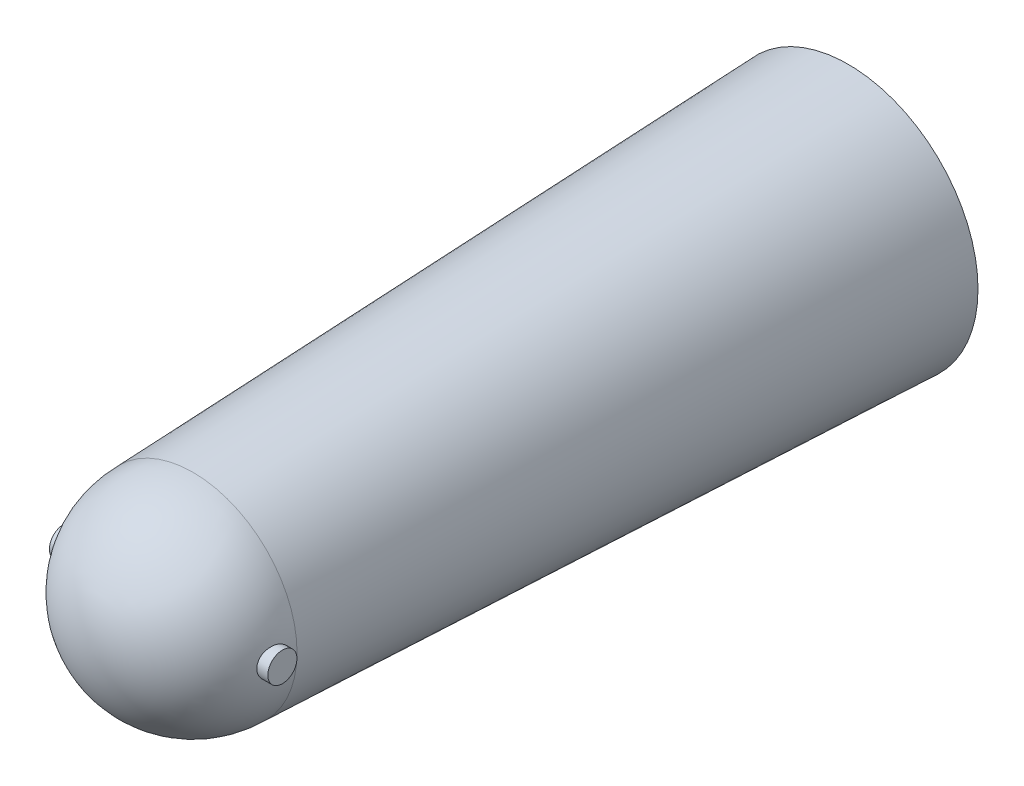
from build123d import *

# Parameters (mm, degrees)
SKETCH1_R           = 89.125
BOSS_EXTRUDE1_DEPTH = 450
BOSS_EXTRUDE1_TAPER = 2.25
SKETCH5_R           = 10
BOSS_EXTRUDE3_DEPTH = 10
SKETCH4_R           = 10
BOSS_EXTRUDE4_DEPTH = 10
SKETCH7_R           = 5
CUT_EXTRUDE1_DEPTH  = 10
CUT_EXTRUDE2_START  = 10
SKETCH6_R           = 5
CUT_EXTRUDE2_DEPTH  = 10


with BuildPart() as part:
    # Sketch1 → Boss-Extrude1 (new body)
    with BuildSketch(Plane.XY):
        Circle(SKETCH1_R)
    extrude(amount=BOSS_EXTRUDE1_DEPTH, taper=BOSS_EXTRUDE1_TAPER)

    # Sketch2 → Revolve1 (revolve)
    with BuildSketch(Plane.XY.offset(450)):
        with BuildLine():
            Line((0, 71.444451847), (0, -71.444451847))
            ThreePointArc((0, -71.444451847), (-71.444451847, 0), (0, 71.444451847))
        make_face()
    revolve(axis=Axis((0, 71.444451847, 450), (0, -1, 0)))

    # Sketch3 → Cut-Revolve1 (revolve, cut)
    with BuildSketch(Plane(origin=(0, 0, 0), x_dir=(-1, 0, 0), z_dir=(0, 0, -1))):
        with BuildLine():
            Line((-79, 0), (79, 0))
            ThreePointArc((79, 0), (0, -79), (-79, 0))
        make_face()
    revolve(axis=Axis((79, 0, 0), (-1, 0, 0)), mode=Mode.SUBTRACT)

    # Sketch7 → Cut-Extrude1 (cut)
    with BuildSketch(Plane(origin=(-65, 0, 0), x_dir=(0, 0, -1), z_dir=(1, 0, 0))):
        with Locations((-25.548083617, 0)):
            Circle(SKETCH7_R)
    extrude(amount=-CUT_EXTRUDE1_DEPTH, mode=Mode.SUBTRACT)

    # Sketch6 → Cut-Extrude2 (cut)
    with BuildSketch(Plane(origin=(65, 0, 0), x_dir=(0, 0, -1), z_dir=(1, 0, 0)).offset(CUT_EXTRUDE2_START)):
        with Locations((-25.548083617, 0)):
            Circle(SKETCH6_R)
    extrude(amount=-CUT_EXTRUDE2_DEPTH, mode=Mode.SUBTRACT)


with BuildPart() as body_2:
    # Sketch5 → Boss-Extrude3 (new body)
    with BuildSketch(Plane(origin=(-65, 0, 0), x_dir=(0, 0, -1), z_dir=(1, 0, 0))):
        with Locations((-463.622716312, 0)):
            Circle(SKETCH5_R)
    extrude(amount=-BOSS_EXTRUDE3_DEPTH)


with BuildPart() as body_3:
    # Sketch4 → Boss-Extrude4 (new body)
    with BuildSketch(Plane(origin=(65, 0, 0), x_dir=(0, 0, -1), z_dir=(1, 0, 0))):
        with Locations((-463.622716312, 0)):
            Circle(SKETCH4_R)
    extrude(amount=BOSS_EXTRUDE4_DEPTH)


solid = Compound([part.part, body_2.part, body_3.part])
